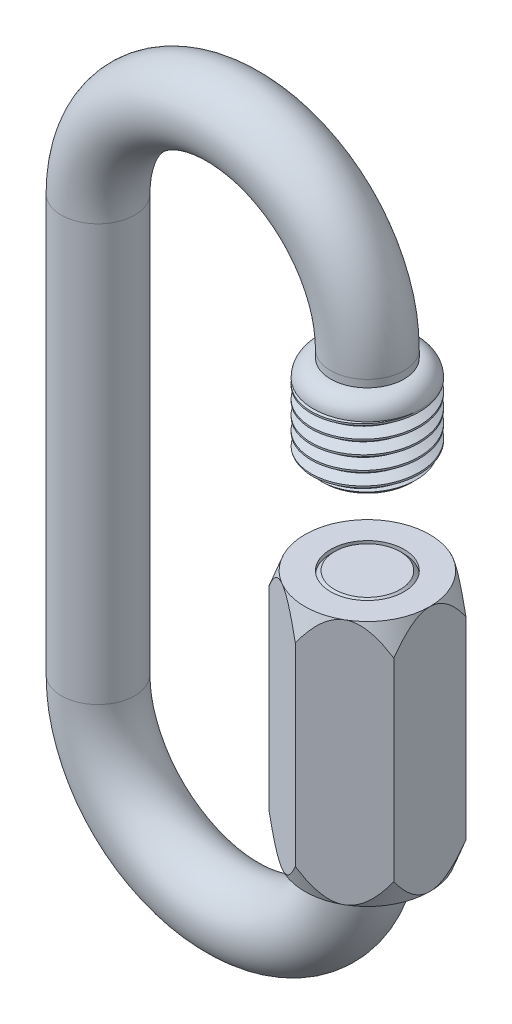
from build123d import *
from build123d.topology import SkipClean

# Parameters (mm, degrees)
SKETCH2_R              = 2.38125
CHAMFER1_SIZE          = 0.254
BOSS_EXTRUDE1_START    = 1.0775
SKETCH6_R              = 2.38125
BOSS_EXTRUDE1_DEPTH    = 16
SKETCH7_OUTSIDE_W      = 58.878
SKETCH7_OUTSIDE_H      = 44.334
SKETCH7_OUTSIDE_R      = 4.048125
CUT_EXTRUDE1_DEPTH     = 30.065739269
CUT_EXTRUDE1_DRAFT     = -20
SKETCH8_OUTSIDE_W      = 68.152
SKETCH8_OUTSIDE_H      = 53.608
SKETCH8_OUTSIDE_R      = 4.048125
CUT_EXTRUDE2_DEPTH     = 42.805313831
CUT_EXTRUDE2_DRAFT     = -20
CUT_SWEEP1_PITCH       = 0.875
CUT_SWEEP1_HEIGHT      = 6.465
CUT_SWEEP1_RADIUS      = 3.5
CUT_SWEEP1_START_ANGLE = 90


with BuildPart() as part:
    # Sweep1: sweep along a path in Sketch3
    with BuildLine(Plane.XY) as sweep1_path:
        Line((8.73125, 7.4275), (8.73125, 13.0175))
        Line((8.73125, 13.0175), (8.73125, 13.49375))
        ThreePointArc((8.73125, 13.49375), (0, 22.225), (-8.73125, 13.49375))
        Line((-8.73125, 13.49375), (-8.73125, -13.49375))
        ThreePointArc((-8.73125, -13.49375), (0, -22.225), (8.73125, -13.49375))
        Line((8.73125, -13.49375), (8.73125, 1.0775))
    # Sketch2 → Sweep1 (sweep)
    with BuildSketch(Plane(origin=(0, 0, 0), x_dir=(1, 0, 0), z_dir=(0, 1, 0))):
        with Locations((-8.73125, 0)):
            Circle(SKETCH2_R)
    sweep(path=sweep1_path.line)

    # Sketch5 → Revolve1 (revolve)
    with BuildSketch(Plane.XY, mode=Mode.PRIVATE) as revolve1_sk:
        with BuildLine():
            Line((8.73125, 7.4275), (11.575, 7.4275))
            Line((11.575, 7.4275), (12.23125, 8.08375))
            Line((12.23125, 8.08375), (12.23125, 11.89875))
            ThreePointArc((12.23125, 11.89875), (11.903575711, 12.689825711), (11.1125, 13.0175))
            Line((11.1125, 13.0175), (8.73125, 13.0175))
            Line((8.73125, 13.0175), (8.73125, 7.4275))
        make_face()
    revolve(revolve1_sk.sketch.rotate(Axis((8.73125, 7.4275, 0), (0, 1, 0)), 90), axis=Axis((8.73125, 7.4275, 0), (0, 1, 0)))

    # Chamfer1
    chamfer1_edges = [part.edges().sort_by_distance(p)[0] for p in [
        (11.1125, 1.0775, 0),
    ]]
    chamfer(chamfer1_edges, length=CHAMFER1_SIZE)


with BuildPart() as body_2:
    # Sketch6 → Boss-Extrude1 (new body)
    with BuildSketch(Plane(origin=(0, 0, 0), x_dir=(1, 0, 0), z_dir=(0, 1, 0)).offset(BOSS_EXTRUDE1_START)):
        Polygon((12.779375, -2.337186058), (12.779375, 2.337186058), (8.73125, 4.674372117), (4.683125, 2.337186058), (4.683125, -2.337186058), (8.73125, -4.674372117), align=None)
        with Locations(Location((8.73125, 0, 0), (0, 0, 270))):
            Circle(SKETCH6_R, mode=Mode.SUBTRACT)
    extrude(amount=-BOSS_EXTRUDE1_DEPTH)


with BuildPart() as cut_extrude1_tool:
    # Sketch7 outside → Cut-Extrude1 (with draft: the straight prism first)
    with BuildSketch(Plane(origin=(0, 1.0775, 0), x_dir=(1, 0, 0), z_dir=(0, 1, 0))):
        with Locations((0.833, 0)):
            Rectangle(SKETCH7_OUTSIDE_W, SKETCH7_OUTSIDE_H)
        with Locations((8.73125, 0)):
            Circle(SKETCH7_OUTSIDE_R, mode=Mode.SUBTRACT)
    extrude(amount=-CUT_EXTRUDE1_DEPTH)
    # Cut-Extrude1: the draft: its side faces are tilted about the plane it starts from
    cut_extrude1_sides = [cut_extrude1_tool.faces().sort_by_distance(p)[0] for p in [
        (0.833, -13.955369635, 22.167),
        (30.272, -13.955369635, 0),
        (0.833, -13.955369635, -22.167),
        (-28.606, -13.955369635, 0),
        (4.683125, -13.955369635, 0),
    ]]
    draft(cut_extrude1_sides, Plane(origin=(0, 1.0775, 0), x_dir=(1, 0, 0), z_dir=(0, 1, 0)), CUT_EXTRUDE1_DRAFT)


with BuildPart() as body_2_1:
    add(body_2.part)

    # Cut-Extrude1: cut by cut_extrude1_tool
    add(cut_extrude1_tool.part, mode=Mode.SUBTRACT)


with BuildPart() as cut_extrude2_tool:
    # Sketch8 outside → Cut-Extrude2 (with draft: the straight prism first)
    with BuildSketch(Plane.XZ.offset(14.9225)):
        with Locations((0.833, 0)):
            Rectangle(SKETCH8_OUTSIDE_W, SKETCH8_OUTSIDE_H)
        with Locations((8.73125, 0)):
            Circle(SKETCH8_OUTSIDE_R, mode=Mode.SUBTRACT)
    extrude(amount=-CUT_EXTRUDE2_DEPTH)
    # Cut-Extrude2: the draft: its side faces are tilted about the plane it starts from
    cut_extrude2_sides = [cut_extrude2_tool.faces().sort_by_distance(p)[0] for p in [
        (0.833, 6.480156916, -26.804),
        (34.909, 6.480156916, 0),
        (0.833, 6.480156916, 26.804),
        (-33.243, 6.480156916, 0),
        (4.683125, 6.480156916, 0),
    ]]
    draft(cut_extrude2_sides, Plane.XZ.offset(14.9225), CUT_EXTRUDE2_DRAFT)


with BuildPart() as body_2_2:
    add(body_2_1.part)

    # Cut-Extrude2: cut by cut_extrude2_tool
    add(cut_extrude2_tool.part, mode=Mode.SUBTRACT)


with BuildPart() as body_3:
    # Split1: the piece on the far side of the plane
    add(part.part)
    split(bisect_by=Plane.ZX.offset(13.0175), keep=Keep.BOTTOM)

    # Cut-Sweep1: sweep along a helix
    with BuildLine() as cut_sweep1_path:
        add(Helix(CUT_SWEEP1_PITCH, CUT_SWEEP1_HEIGHT, CUT_SWEEP1_RADIUS, center=(8.73125, 7.4275, 0), direction=(0, 1, 0), mode=Mode.PRIVATE).rotate(Axis((8.73125, 7.4275, 0), (0, 1, 0)), CUT_SWEEP1_START_ANGLE))
    # Sketch11 → Cut-Sweep1 (sweep, cut)
    with BuildSketch(Plane.XY):
        Polygon((12.278610764, 7.45484375), (11.662920829, 7.099375), (11.662920829, 6.99), (12.278610764, 6.63453125), align=None)
    sweep(path=cut_sweep1_path.line, is_frenet=True, mode=Mode.SUBTRACT)


with BuildPart() as part_1:
    add(part.part)

    # Split1
    split(bisect_by=Plane.ZX.offset(13.0175), keep=Keep.TOP)

    with SkipClean():  # the faces are left unmerged after this step: merging them gives an invalid solid
        add(body_3.part)  # Revolve2 merges body 3
        # Sketch12 → Revolve2 (revolve)
        with BuildSketch(Plane.XY, mode=Mode.PRIVATE) as revolve2_sk:
            with BuildLine():
                Line((11.1125, 13.49375), (11.1125, 13.0175))
                ThreePointArc((11.1125, 13.0175), (11.903575711, 12.689825711), (12.23125, 11.89875))
                Line((12.23125, 11.89875), (8.73125, 11.89875))
                Line((8.73125, 11.89875), (8.73125, 13.49375))
                Line((8.73125, 13.49375), (11.1125, 13.49375))
            make_face()
        revolve(revolve2_sk.sketch.rotate(Axis((8.73125, 13.0175, 0), (0, -1, 0)), 320.591783131), axis=Axis((8.73125, 13.0175, 0), (0, -1, 0)))


solid = Compound([body_2_2.part, part_1.part])
